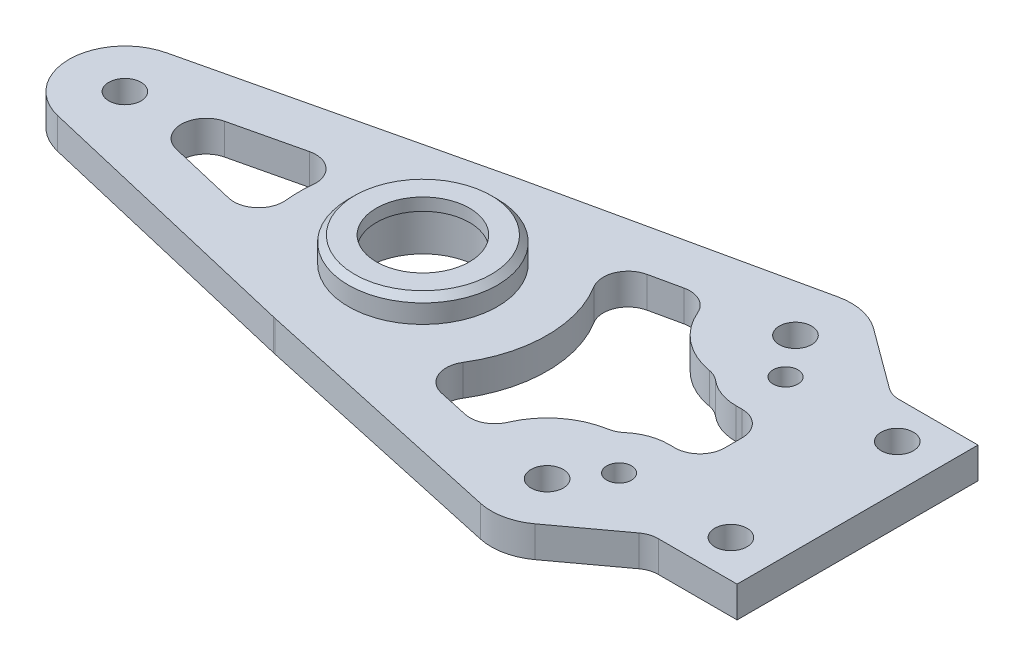
from build123d import *

# Parameters (mm, degrees)
SKETCH1_R           = 1.3
SKETCH1_R_2         = 4.5
SKETCH1_R_3         = 1
BOSS_EXTRUDE1_DEPTH = 2.5
SKETCH3_R           = 6
SKETCH3_R_2         = 3.75
BOSS_EXTRUDE2_DEPTH = 2
SKETCH4_R           = 4.5
SKETCH4_R_2         = 3.75
CUT_EXTRUDE1_DEPTH  = 1
CHAMFER1_SIZE       = 0.5


with BuildPart() as part:
    # Sketch1 → Boss-Extrude1 (new body)
    with BuildSketch(Plane(origin=(0, 0, 0), x_dir=(1, 0, 0), z_dir=(0, 1, 0))):
        with BuildLine():
            Line((35, 9.7), (35, -9.7))
            Line((35, -9.7), (28.656580513, -9.7))
            ThreePointArc((28.656580513, -9.7), (28.032756183, -9.799778117), (27.471175871, -10.089156794))
            Line((27.471175871, -10.089156794), (22.667160445, -13.62438739))
            ThreePointArc((22.667160445, -13.62438739), (20.936486005, -14.401466515), (19.039367435, -14.396259626))
            Line((19.039367435, -14.396259626), (-2.134739034, -9.769487666))
            ThreePointArc((-2.134739034, -9.769487666), (-2.213274492, -9.751995489), (-2.291666667, -9.733871989))
            Line((-2.291666667, -9.733871989), (-25.03125, -4.380242395))
            ThreePointArc((-25.03125, -4.380242395), (-28.5, 0), (-25.03125, 4.380242395))
            Line((-25.03125, 4.380242395), (-2.291666667, 9.733871989))
            ThreePointArc((-2.291666667, 9.733871989), (-2.213276651, 9.751994999), (-2.13474336, 9.769486721))
            Line((-2.13474336, 9.769486721), (19.039365488, 14.396269024))
            ThreePointArc((19.039365488, 14.396269024), (20.936487661, 14.401475987), (22.667164776, 13.624394026))
            Line((22.667164776, 13.624394026), (27.47117527, 10.089158211))
            ThreePointArc((27.47117527, 10.089158211), (28.032756372, 9.799778489), (28.656581837, 9.7))
            Line((28.656581837, 9.7), (35, 9.7))
        make_face()
        with Locations((31.5, 6.7)):
            Circle(SKETCH1_R, mode=Mode.SUBTRACT)
        with Locations((31.5, -6.7)):
            Circle(SKETCH1_R, mode=Mode.SUBTRACT)
        with Locations((20, 10)):
            Circle(SKETCH1_R, mode=Mode.SUBTRACT)
        with Locations((20, -9.999990176)):
            Circle(SKETCH1_R, mode=Mode.SUBTRACT)
        Circle(SKETCH1_R_2, mode=Mode.SUBTRACT)
        with Locations((-24, 0)):
            Circle(SKETCH1_R, mode=Mode.SUBTRACT)
        with Locations((22.5, -6.7)):
            Circle(SKETCH1_R_3, mode=Mode.SUBTRACT)
        with Locations((22.5, 6.7)):
            Circle(SKETCH1_R_3, mode=Mode.SUBTRACT)
        with BuildLine():
            Line((9.772066478, 8.276878442), (12.216286037, 8.810968065))
            ThreePointArc((12.216286037, 8.810968065), (13.559618748, 8.634777191), (14.482426032, 7.642803041))
            ThreePointArc((14.482426032, 7.642803041), (16.274630398, 5.296637232), (18.968838896, 4.089271891))
            ThreePointArc((18.968838896, 4.089271891), (19.472295347, 3.930738723), (19.916745685, 3.646019459))
            ThreePointArc((19.916745685, 3.646019459), (21.124485944, 2.943943413), (22.5, 2.7))
            Line((22.5, 2.7), (23, 2.7))
            ThreePointArc((23, 2.7), (24.414213562, 2.114213562), (25, 0.7))
            Line((25, 0.7), (25, -0.7))
            ThreePointArc((25, -0.7), (24.414213562, -2.114213562), (23, -2.7))
            Line((23, -2.7), (22.5, -2.7))
            ThreePointArc((22.5, -2.7), (21.124485854, -2.943943446), (19.916745538, -3.646019583))
            ThreePointArc((19.916745538, -3.646019583), (19.472295389, -3.930738787), (18.968839153, -4.089271995))
            ThreePointArc((18.968839153, -4.089271995), (16.274635438, -5.296635948), (14.482434575, -7.642798226))
            ThreePointArc((14.482434575, -7.642798226), (13.559627706, -8.634772461), (12.216295281, -8.810963823))
            Line((12.216295281, -8.810963823), (9.772070143, -8.276874115))
            ThreePointArc((9.772070143, -8.276874115), (8.357168863, -7.102458424), (8.499181625, -5.269147152))
            ThreePointArc((8.499181625, -5.269147152), (10, 2.214e-06), (8.499179292, 5.269150915))
            ThreePointArc((8.499179292, 5.269150915), (8.357165718, 7.102462125), (9.772066478, 8.276878442))
        make_face(mode=Mode.SUBTRACT)
        with BuildLine():
            Line((-17.912878788, -1.946774398), (-12.387619024, -3.247598329))
            ThreePointArc((-12.387619024, -3.247598329), (-10.604369925, -2.799022253), (-9.941071409, -1.084019943))
            ThreePointArc((-9.941071409, -1.084019943), (-10, 0), (-9.941071409, 1.084019943))
            ThreePointArc((-9.941071409, 1.084019943), (-10.604369925, 2.799022253), (-12.387619024, 3.247598329))
            Line((-12.387619024, 3.247598329), (-17.912878788, 1.946774398))
            ThreePointArc((-17.912878788, 1.946774398), (-19.454545455, 0), (-17.912878788, -1.946774398))
        make_face(mode=Mode.SUBTRACT)
    extrude(amount=BOSS_EXTRUDE1_DEPTH)

    # Sketch3 → Boss-Extrude2 (add)
    with BuildSketch(Plane(origin=(0, 2.5, 0), x_dir=(1, 0, 0), z_dir=(0, 1, 0))):
        Circle(SKETCH3_R)
        Circle(SKETCH3_R_2, mode=Mode.SUBTRACT)
    extrude(amount=BOSS_EXTRUDE2_DEPTH)

    # Sketch4 → Cut-Extrude1 (cut)
    with BuildSketch(Plane.XZ.offset(-2.5)):
        Circle(SKETCH4_R)
        Circle(SKETCH4_R_2, mode=Mode.SUBTRACT)
    extrude(amount=-CUT_EXTRUDE1_DEPTH, mode=Mode.SUBTRACT)

    # Chamfer1
    chamfer1_edges = [part.edges().sort_by_distance(p)[0] for p in [
        (-6, 4.5, 0),
    ]]
    chamfer(chamfer1_edges, length=CHAMFER1_SIZE)


solid = part.part
